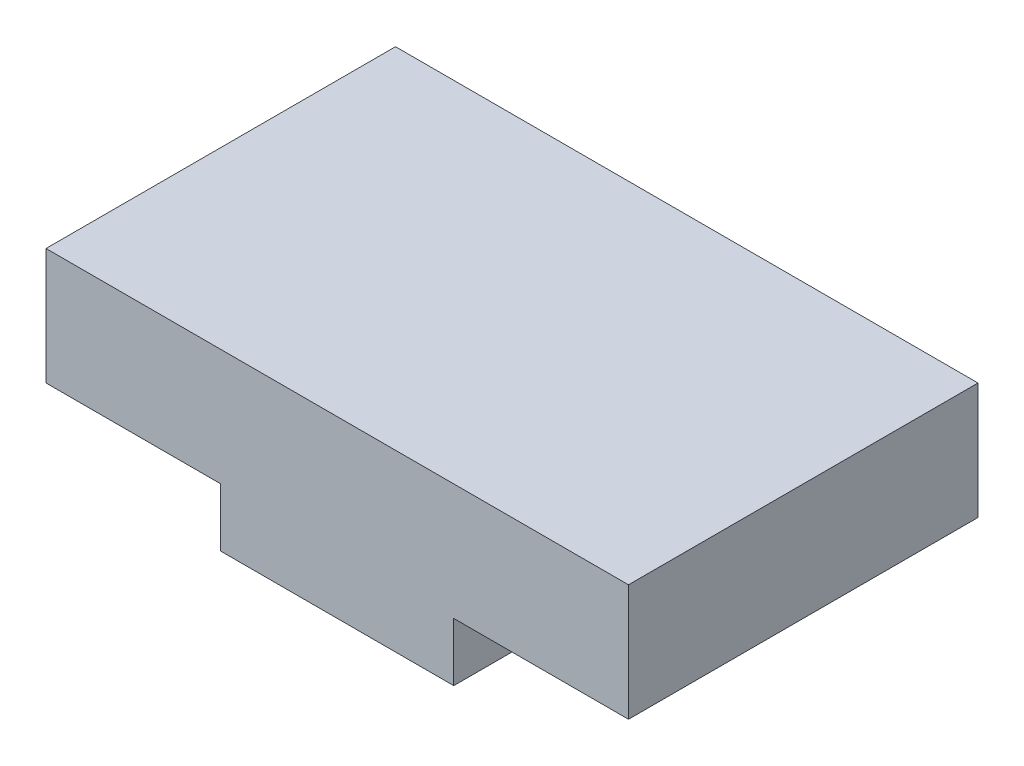
from build123d import *

# Parameters (mm, degrees)
BOSS_EXTRUDE1_DEPTH = 15


with BuildPart() as part:
    # Sketch1 → Boss-Extrude1 (new, symmetric)
    with BuildSketch(Plane.XY):
        Polygon((10, -5), (25, -5), (25, 5), (-25, 5), (-25, -5), (-10, -5), (-10, -10), (10, -10), align=None)
    extrude(amount=BOSS_EXTRUDE1_DEPTH, both=True)


solid = part.part
